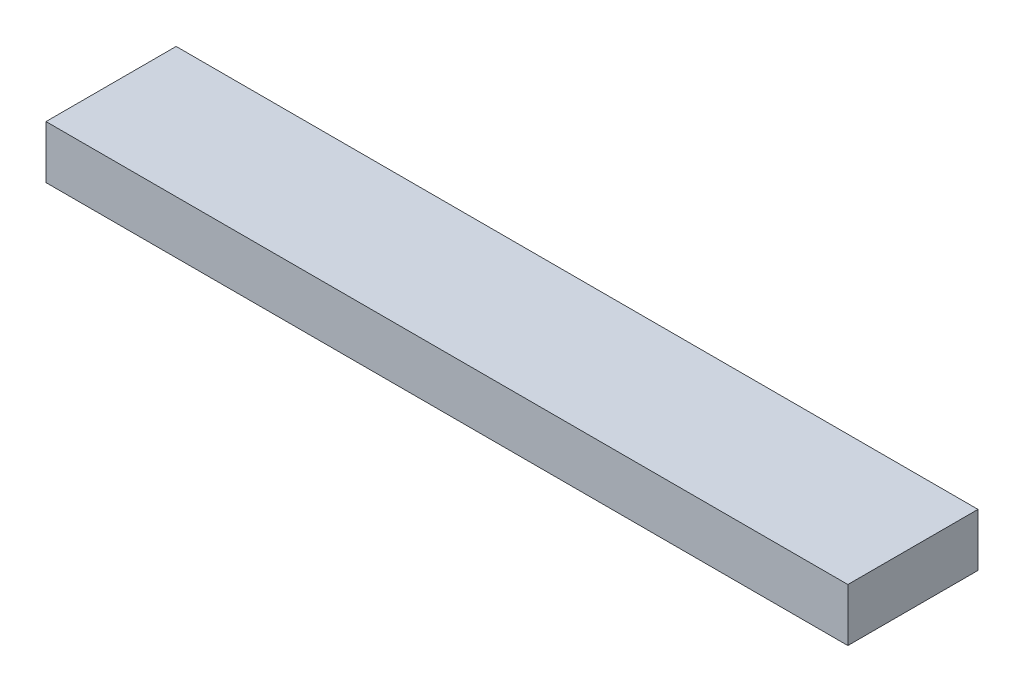
from build123d import *

# Parameters (mm, degrees)
SKETCH1_W           = 47.75
SKETCH1_H           = 7.75
BOSS_EXTRUDE1_DEPTH = 3.15
SHELL1_T            = -1.5
SKETCH2_R           = 1.5
SKETCH2_R_2         = 0.7
BOSS_EXTRUDE2_DEPTH = 1.45


with BuildPart() as part:
    # Sketch1 → Boss-Extrude1 (new body)
    with BuildSketch(Plane(origin=(0, 0, 0), x_dir=(1, 0, 0), z_dir=(0, 1, 0))):
        Rectangle(SKETCH1_W, SKETCH1_H)
    extrude(amount=-BOSS_EXTRUDE1_DEPTH)

    # Shell1
    shell1_openings = [part.faces().sort_by_distance(p)[0] for p in [
        (0, -3.15, 0),
    ]]
    offset(amount=SHELL1_T, openings=shell1_openings, kind=Kind.INTERSECTION)

    # Sketch2 → Boss-Extrude2 (add)
    # profile 1 of 5: a face of its own
    with BuildSketch(Plane.XZ.offset(1.5)):
        with Locations(Location((-15.958333333, 0, 0), (0, 0, 90))):
            Circle(SKETCH2_R)
        with Locations(Location((-15.958333333, 0, 0), (0, 0, 90))):
            Circle(SKETCH2_R_2, mode=Mode.SUBTRACT)
    # profile 2 of 5: a face of its own
    with BuildSketch(Plane.XZ.offset(1.5)):
        with Locations(Location((-8, 0, 0), (0, 0, 90))):
            Circle(SKETCH2_R)
        with Locations(Location((-8, 0, 0), (0, 0, 90))):
            Circle(SKETCH2_R_2, mode=Mode.SUBTRACT)
    # profile 3 of 5: a face of its own
    with BuildSketch(Plane.XZ.offset(1.5)):
        with Locations(Location((-0.041666667, 0, 0), (0, 0, 90))):
            Circle(SKETCH2_R)
        with Locations(Location((-0.041666667, 0, 0), (0, 0, 90))):
            Circle(SKETCH2_R_2, mode=Mode.SUBTRACT)
    # profile 4 of 5: a face of its own
    with BuildSketch(Plane.XZ.offset(1.5)):
        with Locations(Location((7.916666667, 0, 0), (0, 0, 90))):
            Circle(SKETCH2_R)
        with Locations(Location((7.916666667, 0, 0), (0, 0, 90))):
            Circle(SKETCH2_R_2, mode=Mode.SUBTRACT)
    # profile 5 of 5: a face of its own
    with BuildSketch(Plane.XZ.offset(1.5)):
        with Locations(Location((15.875, 0, 0), (0, 0, 90))):
            Circle(SKETCH2_R)
        with Locations(Location((15.875, 0, 0), (0, 0, 90))):
            Circle(SKETCH2_R_2, mode=Mode.SUBTRACT)
    extrude(amount=BOSS_EXTRUDE2_DEPTH)


solid = part.part
